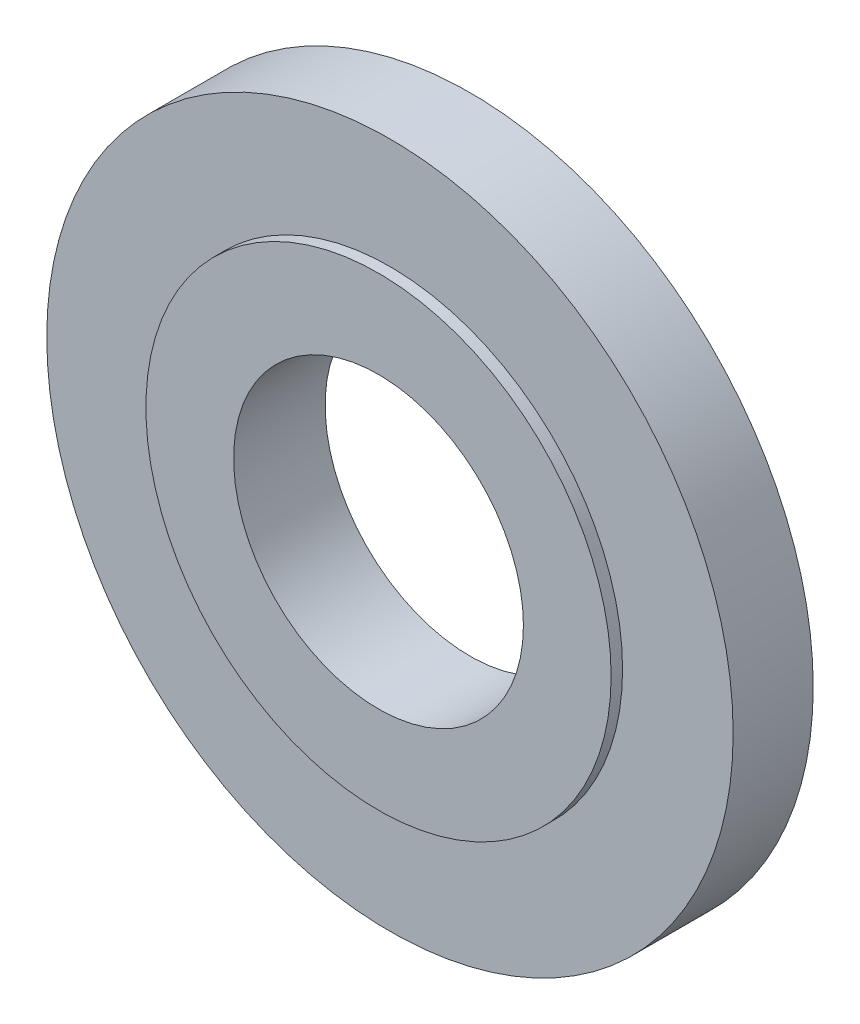
from build123d import *

# Parameters (mm, degrees)
HUB_DIAMETER_R      = 61
HUB_DEPTH           = 24
FLANGE_DIAMETER_R   = 90
FLANGE_DEPTH        = 21
SKETCH_1_R          = 38
CUT_EXTRUDE_1_DEPTH = 130.52219887


with BuildPart() as part:
    # Hub Diameter → Hub (new body)
    with BuildSketch(Plane.XY):
        Circle(HUB_DIAMETER_R)
    extrude(amount=-HUB_DEPTH)

    # Flange Diameter → Flange (add)
    with BuildSketch(Plane.XY.offset(-3)):
        Circle(FLANGE_DIAMETER_R)
    extrude(amount=-FLANGE_DEPTH)

    # Эскиз1 → Вырез-Вытянуть1 (cut, through all)
    with BuildSketch(Plane.XY):
        Circle(SKETCH_1_R)
    extrude(amount=-CUT_EXTRUDE_1_DEPTH, mode=Mode.SUBTRACT)


solid = part.part
